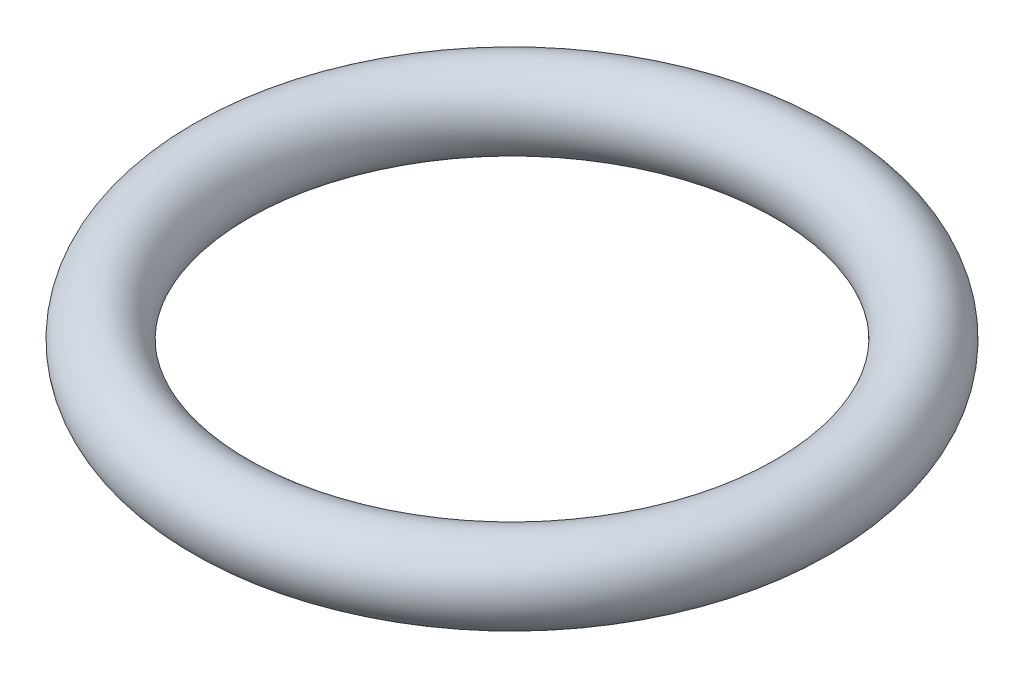
from build123d import *

# Parameters (mm, degrees)
SKETCH1_R = 1.2065


with BuildPart() as part:
    # Sketch1 → Revolve1 (revolve)
    with BuildSketch(Plane.XY, mode=Mode.PRIVATE) as revolve1_sk:
        with Locations((9.0932, 0)):
            Circle(SKETCH1_R)
    revolve(revolve1_sk.sketch.rotate(Axis((0, 9.12195122, 0), (0, -1, 0)), 180), axis=Axis((0, 9.12195122, 0), (0, -1, 0)))


solid = part.part
